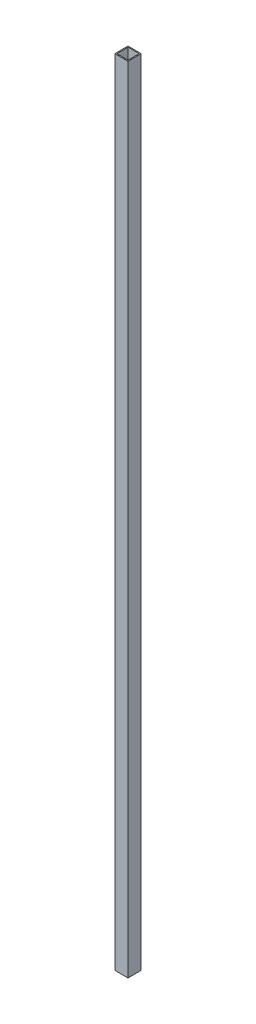
from build123d import *

# Parameters (mm, degrees)
SKETCH1_W           = 25.4
SKETCH1_H           = 25.4
SKETCH1_W_2         = 21.59
SKETCH1_H_2         = 21.59
BOSS_EXTRUDE1_DEPTH = 762


with BuildPart() as part:
    # Sketch1 → Boss-Extrude1 (new, symmetric)
    with BuildSketch(Plane(origin=(0, 0, 0), x_dir=(1, 0, 0), z_dir=(0, 1, 0))):
        Rectangle(SKETCH1_W, SKETCH1_H)
        Rectangle(SKETCH1_W_2, SKETCH1_H_2, mode=Mode.SUBTRACT)
    extrude(amount=BOSS_EXTRUDE1_DEPTH, both=True)


solid = part.part
